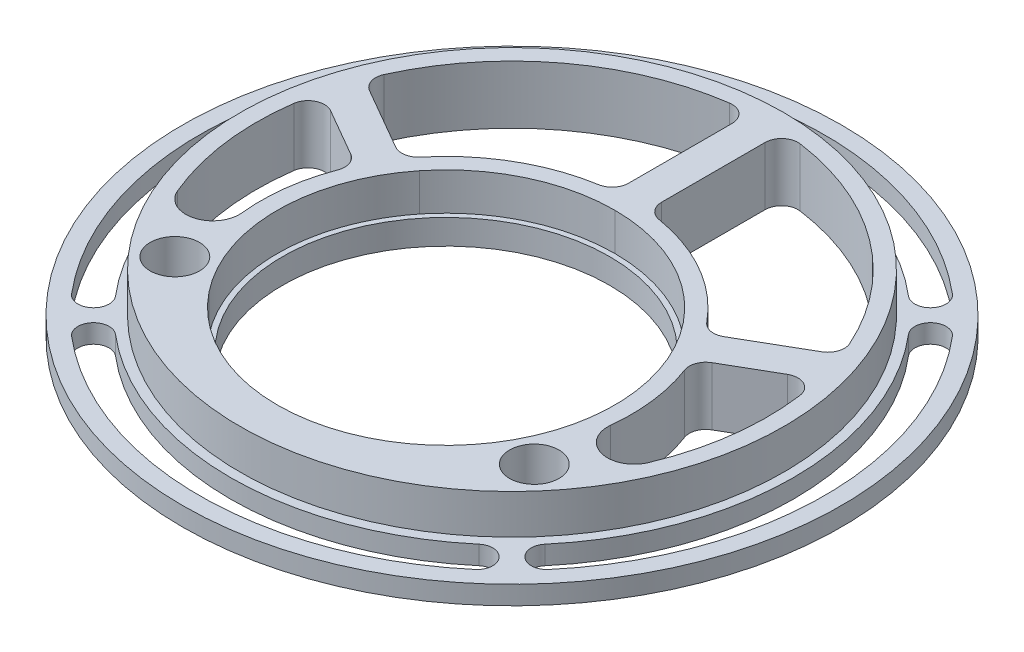
from build123d import *

# Parameters (mm, degrees)
SLOTTED_BODY_EXTRUDE_DEPTH      = 4.191
SLOTTED_BODY_EXTRUDE_DEPTH_BACK = 0.2032
SKETCH1_R                       = 61.9125
SKETCH1_R_2                     = 30.988
SKETCH5_R                       = 52.3875
BOSS_EXTRUDE3_DEPTH             = 7.62
SKETCH6_R                       = 32.512
CUT_EXTRUDE5_DEPTH              = 89.377917571
SKETCH8_R                       = 32.512
SKETCH8_R_2                     = 31.496
BOSS_EXTRUDE4_DEPTH             = 4.795000062
CUT_EXTRUDE7_DEPTH              = 36.068
FILLET1_R                       = 3.175
CUT_EXTRUDE8_DEPTH              = 36.068
MOVE_FACE1_BY                   = 1.5875
MOVE_FACE2_BY                   = 0.79375
SKETCH13_5_R                    = 3.175
CUT_EXTRUDE9_DEPTH              = 91.602654496
MOVE_FACE3_BY                   = 1.5875
MOVE_FACE3_2_BY                 = 1.5875


with BuildPart() as part:
    # Sketch1 → Slotted-Body Extrude (new, two sides: drawn at the far end of the back side and taken through both)
    with BuildSketch(Plane(origin=(0, 0, 0), x_dir=(1, 0, 0), z_dir=(0, 1, 0)).offset(-SLOTTED_BODY_EXTRUDE_DEPTH_BACK)):
        Circle(SKETCH1_R)
        with Locations((0, -12.7)):
            Circle(SKETCH1_R_2, mode=Mode.SUBTRACT)
    extrude(amount=SLOTTED_BODY_EXTRUDE_DEPTH + SLOTTED_BODY_EXTRUDE_DEPTH_BACK)

    # Sketch5 → Boss-Extrude3 (add)
    with BuildSketch(Plane(origin=(0, 4.191, 0), x_dir=(1, 0, 0), z_dir=(0, 1, 0))):
        Circle(SKETCH5_R)
    extrude(amount=BOSS_EXTRUDE3_DEPTH)

    # Sketch6 → Cut-Extrude5 (cut, through all)
    with BuildSketch(Plane.XZ.offset(0.2032)):
        with Locations((0, 12.7)):
            Circle(SKETCH6_R)
    extrude(amount=-CUT_EXTRUDE5_DEPTH, mode=Mode.SUBTRACT)

    # Sketch13 → Cut-Extrude7 (cut)
    with BuildSketch(Plane(origin=(0, 11.811, 0), x_dir=(1, 0, 0), z_dir=(0, 1, 0))):
        with BuildLine():
            Line((-45.989035316, 17.517956129), (-29.195791052, 7.822372033))
            ThreePointArc((-29.195791052, 7.822372033), (-17.8435, 18.205848585), (-3.175, 22.845482751))
            Line((-3.175, 22.845482751), (-3.175, 49.109973847))
            ThreePointArc((-3.175, 49.109973847), (-29.219676385, 39.598998324), (-45.989035316, 17.517956129))
        make_face()
        with BuildLine():
            ThreePointArc((-35.482309697, -16.516761399), (-35.210027203, -6.884851392), (-32.370791052, 2.323110718))
            Line((-32.370791052, 2.323110718), (-47.900191204, 11.289014077))
            ThreePointArc((-47.900191204, 11.289014077), (-49.04223906, -4.09010321), (-45.36846312, -19.06758271))
            ThreePointArc((-45.36846312, -19.06758271), (-39.32308801, -22.064321984), (-35.482309697, -16.516761399))
        make_face()
        with BuildLine():
            Line((3.175, 49.109973847), (3.175, 22.845482751))
            ThreePointArc((3.175, 22.845482751), (17.8435, 18.205848585), (29.195791052, 7.822372033))
            Line((29.195791052, 7.822372033), (45.989035316, 17.517956129))
            ThreePointArc((45.989035316, 17.517956129), (29.219676385, 39.598998324), (3.175, 49.109973847))
        make_face()
        with BuildLine():
            Line((47.900191204, 11.289014077), (32.370791052, 2.323110718))
            ThreePointArc((32.370791052, 2.323110718), (35.210027203, -6.884851392), (35.482309697, -16.516761399))
            ThreePointArc((35.482309697, -16.516761399), (39.32308801, -22.064321984), (45.36846312, -19.06758271))
            ThreePointArc((45.36846312, -19.06758271), (49.04223906, -4.09010321), (47.900191204, 11.289014077))
        make_face()
    extrude(amount=-CUT_EXTRUDE7_DEPTH, mode=Mode.SUBTRACT)

    # Fillet1
    fillet1_edges = [part.edges().sort_by_distance(p)[0] for p in [
        (47.900191204, 5.8039, -11.289014077),
        (32.370791052, 5.8039, -2.323110718),
        (29.195791052, 5.8039, -7.822372033),
        (45.989035316, 5.8039, -17.517956129),
        (3.175, 5.8039, -49.109973847),
        (3.175, 5.8039, -22.845482751),
        (-3.175, 5.8039, -22.845482751),
        (-3.175, 5.8039, -49.109973847),
        (-45.989035316, 5.8039, -17.517956129),
        (-29.195791052, 5.8039, -7.822372033),
        (-32.370791052, 5.8039, -2.323110718),
        (-47.900191204, 5.8039, -11.289014077),
    ]]
    fillet(fillet1_edges, radius=FILLET1_R)

    # Sketch12 → Cut-Extrude8 (cut)
    with BuildSketch(Plane(origin=(0, 4.191, 0), x_dir=(1, 0, 0), z_dir=(0, 1, 0))):
        with BuildLine():
            ThreePointArc((35.017146315, 41.387232889), (39.245117901, 41.739732907), (38.892617883, 45.967704494))
            ThreePointArc((38.892617883, 45.967704494), (0, 60.2135), (-38.892617883, 45.967704494))
            ThreePointArc((-38.892617883, 45.967704494), (-39.245117901, 41.739732907), (-35.017146315, 41.387232889))
            ThreePointArc((-35.017146315, 41.387232889), (-18.646136758, 50.906042532), (0, 54.2135))
            ThreePointArc((0, 54.2135), (18.646136758, 50.906042532), (35.017146315, 41.387232889))
        make_face()
        with BuildLine():
            ThreePointArc((-41.387232889, 35.017146315), (-41.739732907, 39.245117901), (-45.967704494, 38.892617883))
            ThreePointArc((-45.967704494, 38.892617883), (-60.2135, 0), (-45.967704494, -38.892617883))
            ThreePointArc((-45.967704494, -38.892617883), (-41.739732907, -39.245117901), (-41.387232889, -35.017146315))
            ThreePointArc((-41.387232889, -35.017146315), (-54.2135, 0), (-41.387232889, 35.017146315))
        make_face()
        with BuildLine():
            ThreePointArc((41.387232889, -35.017146315), (41.739732907, -39.245117901), (45.967704494, -38.892617883))
            ThreePointArc((45.967704494, -38.892617883), (60.2135, 0), (45.967704494, 38.892617883))
            ThreePointArc((45.967704494, 38.892617883), (41.739732907, 39.245117901), (41.387232889, 35.017146315))
            ThreePointArc((41.387232889, 35.017146315), (54.2135, 0), (41.387232889, -35.017146315))
        make_face()
        with BuildLine():
            ThreePointArc((-35.017146315, -41.387232889), (-39.245117901, -41.739732907), (-38.892617883, -45.967704494))
            ThreePointArc((-38.892617883, -45.967704494), (0, -60.2135), (38.892617883, -45.967704494))
            ThreePointArc((38.892617883, -45.967704494), (39.245117901, -41.739732907), (35.017146315, -41.387232889))
            ThreePointArc((35.017146315, -41.387232889), (0, -54.2135), (-35.017146315, -41.387232889))
        make_face()
    extrude(amount=-CUT_EXTRUDE8_DEPTH, mode=Mode.SUBTRACT)

    # Move Face1: a curved face moved outward by 1.5875
    add(Solid.thicken(part.faces().sort_by_distance((-61.9125, 1.9939, 0))[0], MOVE_FACE1_BY))

    # Move Face2: a face moved inward by 0.79375
    extrude(part.faces().sort_by_distance((0, -0.2032, -31.75))[0], amount=MOVE_FACE2_BY, dir=(0, 1, 0), mode=Mode.SUBTRACT)

    # Sketch13<5> → Cut-Extrude9 (cut, through all)
    with BuildSketch(Plane(origin=(0, 11.811, 0), x_dir=(1, 0, 0), z_dir=(0, 1, 0))):
        with Locations((-34.630813629, -30.33410875)):
            Circle(SKETCH13_5_R)
        with Locations((34.630813629, -30.33410875)):
            Circle(SKETCH13_5_R)
    extrude(amount=-CUT_EXTRUDE9_DEPTH, mode=Mode.SUBTRACT)

    # Move Face3: a curved face moved inward by 1.5875
    add(Solid.thicken(part.faces().sort_by_distance((31.455813629, 6.200775, 30.33410875))[0], -MOVE_FACE3_BY), mode=Mode.SUBTRACT)

    # Move Face3 2: a curved face moved inward by 1.5875
    add(Solid.thicken(part.faces().sort_by_distance((-37.805813629, 6.200775, 30.33410875))[0], -MOVE_FACE3_2_BY), mode=Mode.SUBTRACT)


with BuildPart() as body_2:
    # Sketch8 → Boss-Extrude4 (new body)
    with BuildSketch(Plane.XZ.offset(0.2032)):
        with Locations((0, 12.7)):
            Circle(SKETCH8_R)
        with Locations((0, 12.7)):
            Circle(SKETCH8_R_2, mode=Mode.SUBTRACT)
    extrude(amount=-BOSS_EXTRUDE4_DEPTH)


solid = Compound([part.part, body_2.part])
